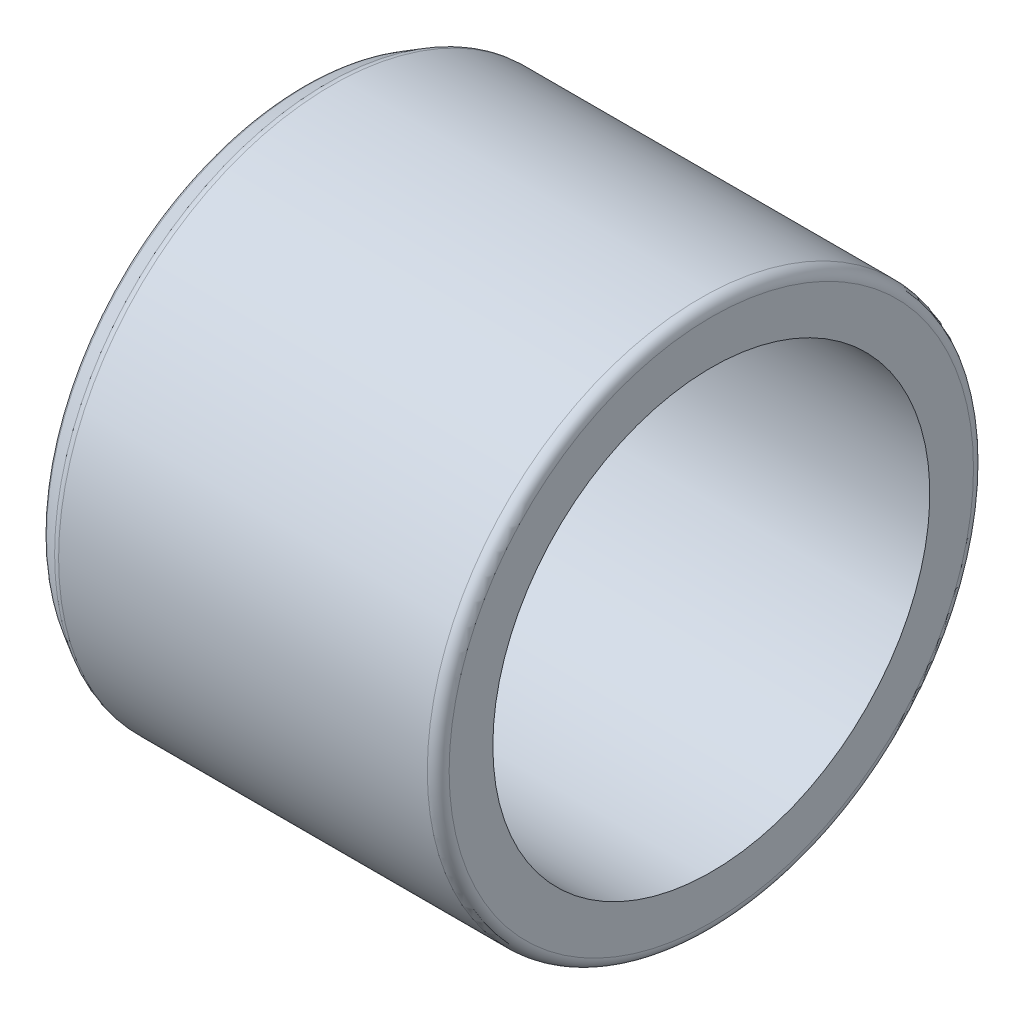
from build123d import *


with BuildPart() as part:
    # Эскиз1 → Повернуть1 (revolve)
    with BuildSketch(Plane.XY):
        with BuildLine():
            Line((18.75, 20), (18.75, 24))
            ThreePointArc((18.75, 24), (18.457106781, 24.707106781), (17.75, 25))
            Line((17.75, 25), (-16, 25))
            ThreePointArc((-16, 25), (-16.258819045, 24.965925826), (-16.5, 24.866025404))
            Line((-16.5, 24.866025404), (-18.25, 23.855662433))
            ThreePointArc((-18.25, 23.855662433), (-18.616025404, 23.489637029), (-18.75, 22.989637029))
            Line((-18.75, 22.989637029), (-18.75, 19.1))
            ThreePointArc((-18.75, 19.1), (-18.457106781, 18.392893219), (-17.75, 18.1))
            Line((-17.75, 18.1), (-16, 18.1))
            Line((-16, 18.1), (-16, 20))
            Line((-16, 20), (18.75, 20))
        make_face()
    revolve(axis=Axis((-18.75, 0, 0), (1, 0, 0)))


solid = part.part
